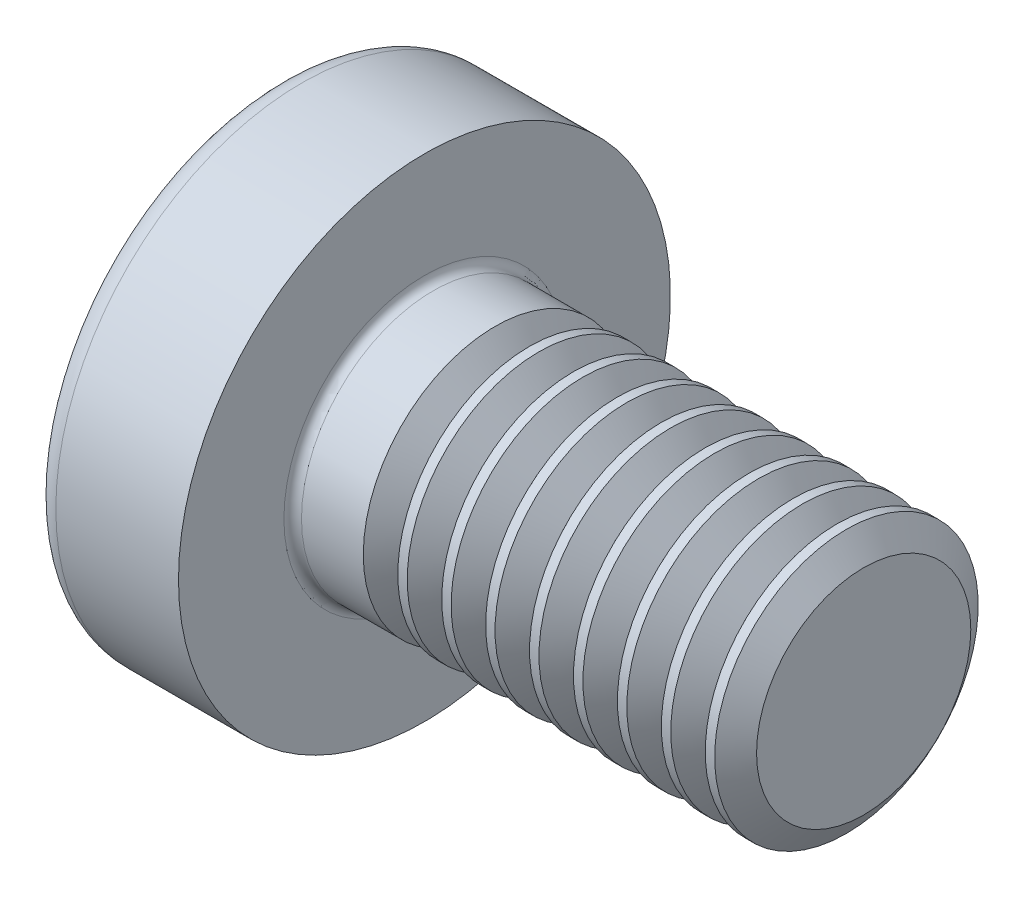
from build123d import *

# Parameters (mm, degrees)
FILLET1_R       = 0.1
RECPAT_COUNT    = 2
RECPAT_ANGLE    = 90
THDSCHPAT_COUNT = 9
THDSCHPAT_PITCH = 0.5


with BuildPart() as part:
    # BodySke → Base-Revolve (revolve)
    with BuildSketch(Plane.XY, mode=Mode.PRIVATE) as base_revolve_sk:
        with BuildLine():
            Line((2.4, 1.5), (2.4, 2.8))
            Line((2.4, 2.8), (1.003501533, 2.8))
            ThreePointArc((1.003501533, 2.8), (0.873295971, 2.76653015), (0.775371599, 2.674418605))
            ThreePointArc((0.775371599, 2.674418605), (0.197753546, 1.392274756), (0, 0))
            Line((0, 0), (7.4, 0))
            Line((7.4, 0), (7.4, 1.5))
            Line((7.4, 1.5), (2.4, 1.5))
        make_face()
    revolve(base_revolve_sk.sketch.rotate(Axis((1.003501533, 0, 0), (1, 0, 0)), 90), axis=Axis((1.003501533, 0, 0), (1, 0, 0)))

    # Fillet1
    fillet1_edges = [part.edges().sort_by_distance(p)[0] for p in [
        (2.4, 0, -1.5),
    ]]
    fillet(fillet1_edges, radius=FILLET1_R)

    # Sketch3 → Recess section 0
    with BuildSketch(Plane(origin=(0, 0, 0), x_dir=(0, 0, -1), z_dir=(1, 0, 0))):
        with BuildLine():
            Line((0.37, -1.4), (-0.37, -1.4))
            Line((-0.37, -1.4), (-0.37, 1.4))
            Line((-0.37, 1.4), (0.37, 1.4))
            Line((0.37, 1.4), (0.37, -1.4))
        make_face()
    # Sketch4 → Recess section 1
    with BuildSketch(Plane(origin=(1.75, 0, 0), x_dir=(0, 0, -1), z_dir=(1, 0, 0))):
        with BuildLine():
            Line((0.37, -0.527482332), (-0.37, -0.527482332))
            Line((-0.37, -0.527482332), (-0.37, 0.527482332))
            Line((-0.37, 0.527482332), (0.37, 0.527482332))
            Line((0.37, 0.527482332), (0.37, -0.527482332))
        make_face()
    recess = loft(mode=Mode.SUBTRACT)

    # RecPat: Recess ×2 about axis
    recpat_axis = Axis((0, 0, 0), (1, 0, 0))
    for i in range(1, RECPAT_COUNT):
        add(recess.rotate(recpat_axis, i * RECPAT_ANGLE / (RECPAT_COUNT - 1)), mode=Mode.SUBTRACT)

    # RecCorSke → RecessCore (revolve, cut)
    with BuildSketch(Plane.XY, mode=Mode.PRIVATE) as recesscore_sk:
        Polygon((0, 0), (0, 0.678371921), (1.75, 0.556), (1.930655351, 0), align=None)
    revolve(recesscore_sk.sketch.rotate(Axis((-3.175, 0, 0), (1, 0, 0)), 344.185974362), axis=Axis((-3.175, 0, 0), (1, 0, 0)), mode=Mode.SUBTRACT)

    # ThdSchSke → ThreadSchematic (revolve, cut)
    with BuildSketch(Plane.XY, mode=Mode.PRIVATE) as threadschematic_sk:
        Polygon((3.4, -1.2195), (3.203591786, -1.5), (3.203591786, -1.875), (3.596408214, -1.875), (3.596408214, -1.5), align=None)
    threadschematic = revolve(threadschematic_sk.sketch.rotate(Axis((-3.175, 0, 0), (1, 0, 0)), 270), axis=Axis((-3.175, 0, 0), (1, 0, 0)), mode=Mode.SUBTRACT)

    # ThdSchPat: ThreadSchematic ×9
    with Locations(*[(i * THDSCHPAT_PITCH, 0, 0) for i in range(1, THDSCHPAT_COUNT)]):
        add(threadschematic, mode=Mode.SUBTRACT)


solid = part.part
